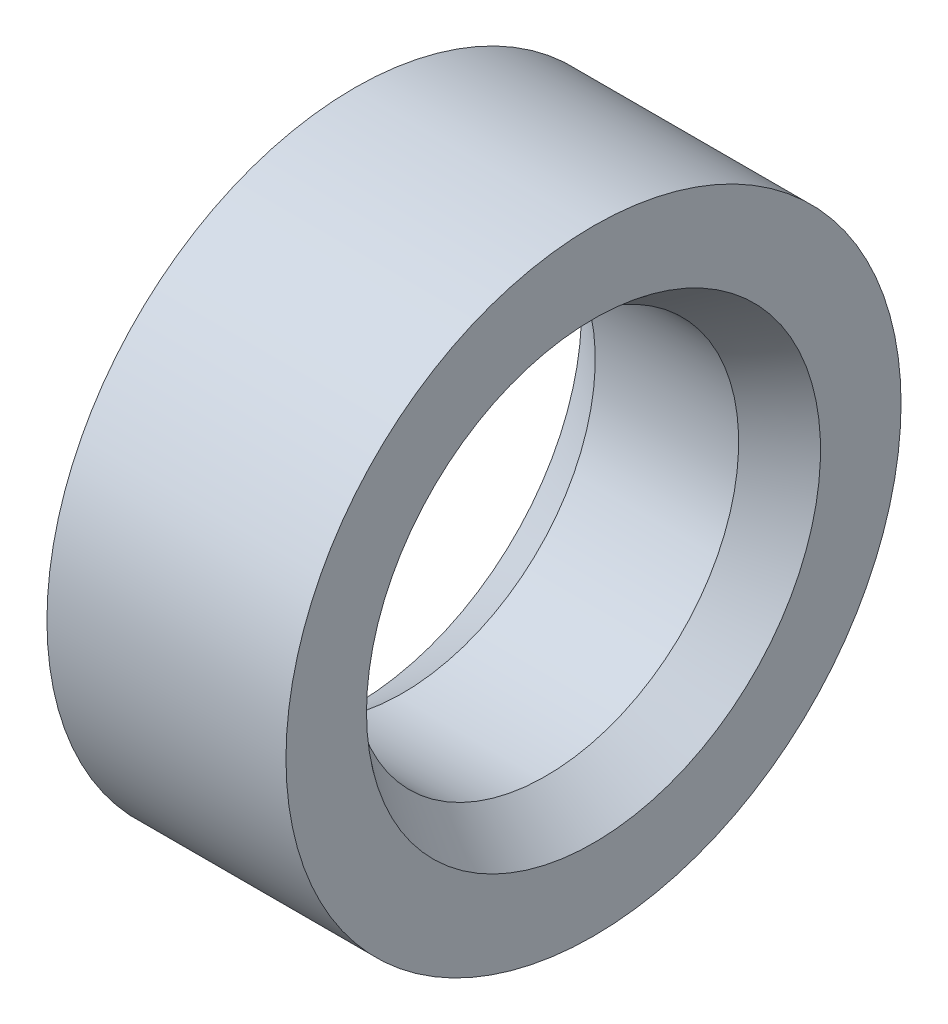
from build123d import *


with BuildPart() as part:
    # Эскиз1 → Повернуть1 (revolve)
    with BuildSketch(Plane.XY, mode=Mode.PRIVATE) as revolve_1_sk:
        Polygon((-10.847112909, 5), (-10.847112909, 6.773556454), (-5.582677453, 6.773556454), (-5.582677453, 5), (-6.635564544, 4.25), (-9.794225818, 4.25), align=None)
    revolve(revolve_1_sk.sketch.rotate(Axis((-1000, 0, 0), (1, 0, 0)), 90), axis=Axis((-1000, 0, 0), (1, 0, 0)))


solid = part.part
